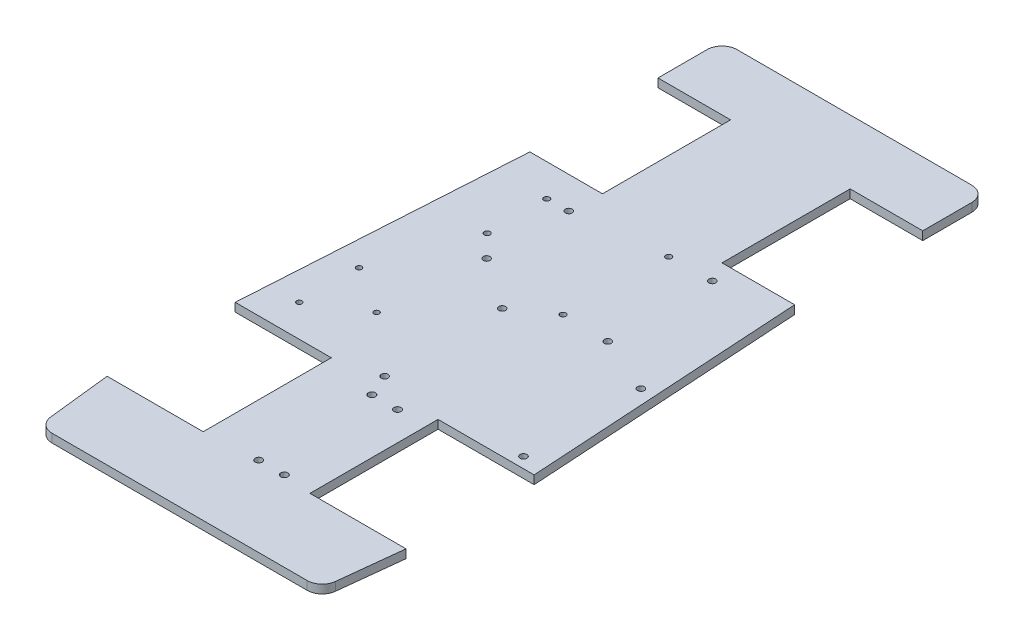
from build123d import *

# Parameters (mm, degrees)
BOSS_EXTRUDE1_DEPTH                        = 4
F_3_3_3_3_GATEN_TANDWIELKAST_D             = 3.3
F_2_5_2_5_BATTERIJ_HOUDER_D                = 2.5
F_2_7_2_7_ARDUINO_GATEN_D2_7_D             = 2.7
F_3_2_3_2_ARDUINO_GATEN_D3_2_D             = 3.2
F_3_2_3_2_BREADBOARD_ONDERSTEUNINGSPLAAT_D = 3.2


with BuildPart() as part:
    # grondplaat groene golf → Boss-Extrude1 (new body)
    with BuildSketch(Plane(origin=(0, 0, 0), x_dir=(1, 0, 0), z_dir=(0, 1, 0))):
        with BuildLine():
            Line((-55, 0), (55, 0))
            ThreePointArc((55, 0), (59.949747468, -2.050252532), (62, -7))
            Line((62, -7), (62, -30))
            Line((62, -30), (28, -30))
            Line((28, -30), (28, -90))
            Line((28, -90), (62, -90))
            Line((62, -90), (70, -220))
            Line((70, -220), (25, -220))
            Line((25, -220), (25, -280))
            Line((25, -280), (70, -280))
            Line((70, -280), (66.691886591, -309.773020683))
            ThreePointArc((66.691886591, -309.773020683), (64.403150685, -314.215896125), (59.734700448, -316))
            Line((59.734700448, -316), (-59.734700448, -316))
            ThreePointArc((-59.734700448, -316), (-64.403150685, -314.215896125), (-66.691886591, -309.773020683))
            Line((-66.691886591, -309.773020683), (-70, -280))
            Line((-70, -280), (-25, -280))
            Line((-25, -280), (-25, -220))
            Line((-25, -220), (-70, -220))
            Line((-70, -220), (-62, -90))
            Line((-62, -90), (-28, -90))
            Line((-28, -90), (-28, -30))
            Line((-28, -30), (-62, -30))
            Line((-62, -30), (-62, -7))
            ThreePointArc((-62, -7), (-59.949747468, -2.050252532), (-55, 0))
        make_face()
    extrude(amount=BOSS_EXTRUDE1_DEPTH)

    # Ø3.3 (3.3) gaten tandwielkast (through all)
    with Locations(Plane(origin=(0, 4, 0), x_dir=(1, 0, 0), z_dir=(0, 1, 0))):
        with Locations((11.5, -278.5), (-0.5, -278.5), (-0.5, -225.5), (11.5, -225.5)):
            Hole(F_3_3_3_3_GATEN_TANDWIELKAST_D / 2)

    # Ø2.5 (2.5) batterij houder (through all)
    with Locations(Plane(origin=(0, 4, 0), x_dir=(1, 0, 0), z_dir=(0, 1, 0))):
        with Locations((-55, -205), (-32.8, -191), (-55, -177)):
            Hole(F_2_5_2_5_BATTERIJ_HOUDER_D / 2)

    # Ø2.7 (2.7) Arduino gaten D2.7 (through all)
    with Locations(Plane(origin=(0, 4, 0), x_dir=(1, 0, 0), z_dir=(0, 1, 0))):
        with Locations((-39, -105.09), (-39, -133), (11.76, -148.23), (13.03, -100.01)):
            Hole(F_2_7_2_7_ARDUINO_GATEN_D2_7_D / 2)

    # Ø3.2 (3.2) Arduino gaten D3.2 (through all)
    with Locations(Plane(origin=(0, 4, 0), x_dir=(1, 0, 0), z_dir=(0, 1, 0))):
        with Locations((-28.9, -104.87), (-28.9, -143.37), (33.1, -99.62), (33.1, -148.62)):
            Hole(F_3_2_3_2_ARDUINO_GATEN_D3_2_D / 2)

    # Ø3.2 (3.2) Breadboard ondersteuningsplaatje (through all)
    with Locations(Plane(origin=(0, 4, 0), x_dir=(1, 0, 0), z_dir=(0, 1, 0))):
        with Locations((-5, -160), (60, -160), (-5, -215), (60, -215)):
            Hole(F_3_2_3_2_BREADBOARD_ONDERSTEUNINGSPLAAT_D / 2)


solid = part.part
